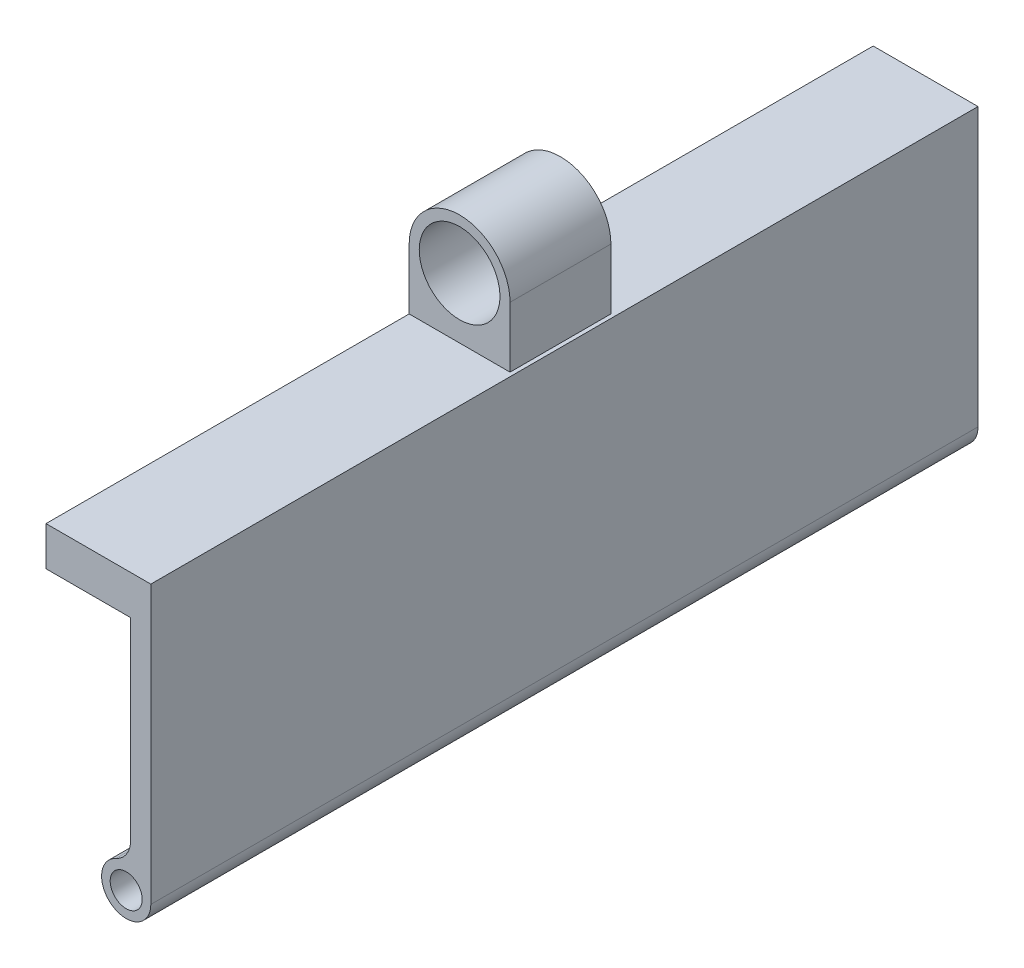
from build123d import *

# Parameters (mm, degrees)
SKETCH1_R           = 1.5875
BOSS_EXTRUDE1_DEPTH = 82
SKETCH3_W           = 2
SKETCH3_H           = 82
BOSS_EXTRUDE4_DEPTH = 2.5
SKETCH6_W           = 82
SKETCH6_H           = 3.880734095
BOSS_EXTRUDE5_DEPTH = 8.39
BOSS_EXTRUDE6_START = -36
SKETCH8_R           = 4
BOSS_EXTRUDE6_DEPTH = 10
SKETCH10_W          = 11.720322
SKETCH10_H          = 6.929988864
CUT_EXTRUDE1_DEPTH  = 10
LPATTERN1_COUNT     = 3
LPATTERN1_PITCH     = 23.440644


with BuildPart() as part:
    # Sketch1 → Boss-Extrude1 (new body)
    with BuildSketch(Plane.XY):
        with BuildLine():
            Line((2.44, 0), (2.44, 25))
            Line((2.44, 25), (0.44, 25))
            Line((0.44, 25), (0.44, 4.489988864))
            ThreePointArc((0.44, 4.489988864), (0.044314057, 3.140225052), (-1.017489879, 2.217727293))
            ThreePointArc((-1.017489879, 2.217727293), (-1.317369481, -2.05381052), (2.44, 0))
        make_face()
        Circle(SKETCH1_R, mode=Mode.SUBTRACT)
    extrude(amount=BOSS_EXTRUDE1_DEPTH)

    # Sketch3 → Boss-Extrude4 (add)
    with BuildSketch(Plane(origin=(0, 25, 0), x_dir=(1, 0, 0), z_dir=(0, 1, 0))):
        with Locations((1.44, -41)):
            Rectangle(SKETCH3_W, SKETCH3_H)
    extrude(amount=BOSS_EXTRUDE4_DEPTH)

    # Sketch6 → Boss-Extrude5 (add)
    with BuildSketch(Plane.ZY.offset(-0.44)):
        with Locations((41, 25.559632953)):
            Rectangle(SKETCH6_W, SKETCH6_H)
    extrude(amount=BOSS_EXTRUDE5_DEPTH)

    # Sketch8 → Boss-Extrude6 (add)
    with BuildSketch(Plane(origin=(0, 0, 0), x_dir=(-1, 0, 0), z_dir=(0, 0, -1)).offset(BOSS_EXTRUDE6_START)):
        with BuildLine():
            Line((7.95, 27.5), (7.95, 33.5))
            ThreePointArc((7.95, 33.5), (2.95, 38.5), (-2.05, 33.5))
            Line((-2.05, 33.5), (-2.05, 27.5))
            Line((-2.05, 27.5), (7.95, 27.5))
        make_face()
        with Locations((2.95, 33.5)):
            Circle(SKETCH8_R, mode=Mode.SUBTRACT)
    extrude(amount=-BOSS_EXTRUDE6_DEPTH)

    # Sketch10 → Cut-Extrude1 (cut)
    with BuildSketch(Plane.ZY.offset(-0.44)):
        with Locations((17.580483, 1.024994432)):
            Rectangle(SKETCH10_W, SKETCH10_H)
    cut_extrude1 = extrude(amount=CUT_EXTRUDE1_DEPTH, mode=Mode.SUBTRACT)

    # LPattern1: Cut-Extrude1 ×3
    with Locations(*[(0, 0, i * LPATTERN1_PITCH) for i in range(1, LPATTERN1_COUNT)]):
        add(cut_extrude1, mode=Mode.SUBTRACT)


solid = part.part
